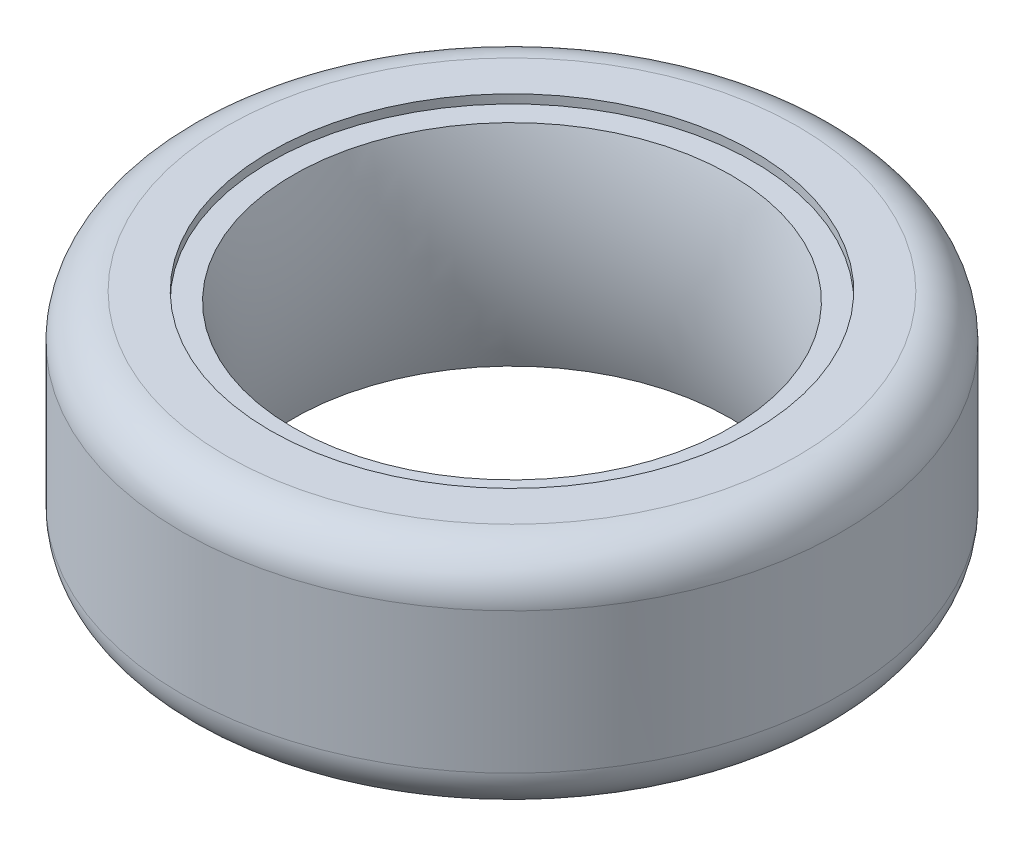
from build123d import *

# Parameters (mm, degrees)
FILLET1_R = 5


with BuildPart() as part:
    # Sketch1 → Revolve3 (revolve)
    with BuildSketch(Plane.XY, mode=Mode.PRIVATE) as revolve3_sk:
        with BuildLine():
            Line((-27.5, -13), (-27.5, -12))
            Line((-27.5, -12), (-24.9, -12))
            ThreePointArc((-24.9, -12), (-23.057568057, 0), (-24.9, 12))
            Line((-24.9, 12), (-27.5, 12))
            Line((-27.5, 12), (-27.5, 13))
            Line((-27.5, 13), (-37.5, 13))
            Line((-37.5, 13), (-37.5, -13))
            Line((-37.5, -13), (-27.5, -13))
        make_face()
    revolve(revolve3_sk.sketch.rotate(Axis((0, 39.143904287, 0), (0, -1, 0)), 270), axis=Axis((0, 39.143904287, 0), (0, -1, 0)))

    # Fillet1
    fillet1_edges = [part.edges().sort_by_distance(p)[0] for p in [
        (0, -13, -37.5),
        (0, 13, -37.5),
    ]]
    fillet(fillet1_edges, radius=FILLET1_R)


solid = part.part
